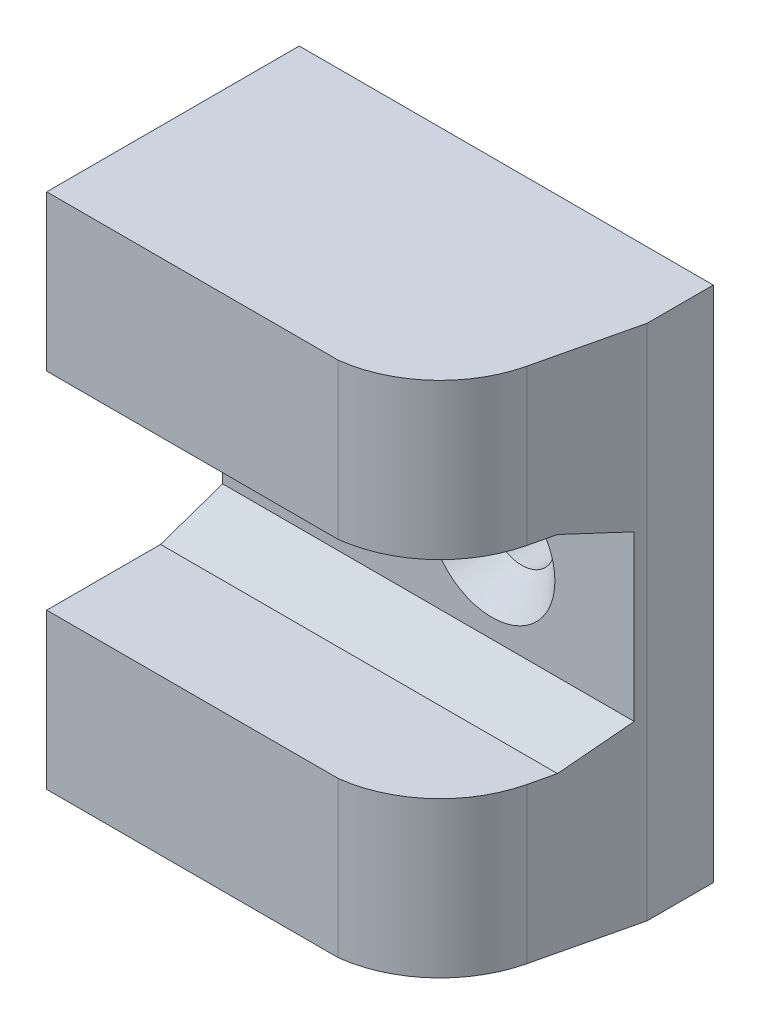
from build123d import *
from OCP.BRepFilletAPI import BRepFilletAPI_MakeChamfer

# Parameters (mm, degrees)
SKETCH_1_W                = 20
SKETCH_1_H                = 25
EXTRUDE_1_DEPTH           = 12.2
CUT_EXTRUDE_1_DEPTH       = 26.5
SKETCH_3_W                = 20
SKETCH_3_H                = 10
CUT_EXTRUDE_2_DEPTH       = 8.5
HOLE_WIZARD_1_D           = 3.2
HOLE_WIZARD_1_CSINK_D     = 6.1
HOLE_WIZARD_1_CSINK_ANGLE = 90
CHAMFER_1_SIZE            = 3
CHAMFER_1_SIZE2           = 1.03298284


with BuildPart() as part:
    # 草图1 → 凸台-拉伸1 (new body)
    with BuildSketch(Plane.XY):
        with Locations((117, 92.5)):
            Rectangle(SKETCH_1_W, SKETCH_1_H)
    extrude(amount=EXTRUDE_1_DEPTH)

    # 草图2 → 切除-拉伸1 (cut)
    with BuildSketch(Plane(origin=(0, 105, 0), x_dir=(1, 0, 0), z_dir=(0, 1, 0))):
        with BuildLine():
            Line((125.890619014, -7.895997518), (127, -3.195997518))
            Line((127, -3.195997518), (127, -12.2))
            Line((127, -12.2), (121.083012976, -12.2))
            ThreePointArc((121.083012976, -12.2), (124.162916731, -10.803208822), (125.890619014, -7.895997518))
        make_face()
    extrude(amount=-CUT_EXTRUDE_1_DEPTH, mode=Mode.SUBTRACT)

    # 草图3 → 切除-拉伸2 (cut)
    with BuildSketch(Plane.XY.offset(12.2)):
        with Locations((117, 92.5)):
            Rectangle(SKETCH_3_W, SKETCH_3_H)
    extrude(amount=-CUT_EXTRUDE_2_DEPTH, mode=Mode.SUBTRACT)

    # 打孔尺寸(%根据)内六角花形半沉头螺钉的类型1 (through all)
    with Locations(Plane.XY.offset(3.7)):
        with Locations((112, 92.5), (120, 92.5)):
            CounterSinkHole(HOLE_WIZARD_1_D / 2, HOLE_WIZARD_1_CSINK_D / 2, counter_sink_angle=HOLE_WIZARD_1_CSINK_ANGLE)

    # 倒角1: one chamfer whose edges measure the first distance from different faces: ONE call of the kernel's chamfer builder (chamfer() names one face for all edges)
    chamfer_1_edges_1 = [part.edges().sort_by_distance(p)[0] for p in [
        (116.940518003, 87.5, 3.7),
    ]]
    chamfer_1_side_1 = [part.faces().sort_by_distance(p)[0] for p in [
        (116.264670273, 87.5, 7.794514486),
    ]]
    chamfer_1_edges_2 = [part.edges().sort_by_distance(p)[0] for p in [
        (116.940518003, 97.5, 3.7),
    ]]
    chamfer_1_side_2 = [part.faces().sort_by_distance(p)[0] for p in [
        (116.264670273, 97.5, 7.794514486),
    ]]
    chamfer_1 = BRepFilletAPI_MakeChamfer(part.part.solid().wrapped)
    for e in chamfer_1_edges_1:
        chamfer_1.Add(CHAMFER_1_SIZE, CHAMFER_1_SIZE2, e.wrapped, chamfer_1_side_1[0].wrapped)  # the first distance lies on this face
    for e in chamfer_1_edges_2:
        chamfer_1.Add(CHAMFER_1_SIZE, CHAMFER_1_SIZE2, e.wrapped, chamfer_1_side_2[0].wrapped)  # the first distance lies on this face
    add(Compound.cast(chamfer_1.Shape()), mode=Mode.REPLACE)


solid = part.part
